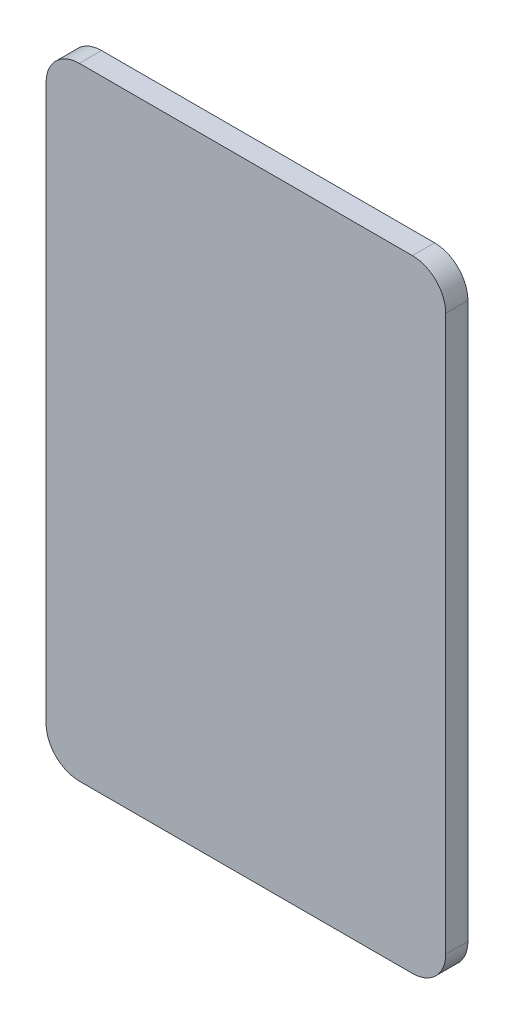
from build123d import *

# Parameters (mm, degrees)
BOSS_EXTRUDE1_DEPTH = 20


with BuildPart() as part:
    # Sketch1 → Boss-Extrude1 (new body)
    with BuildSketch(Plane.XY):
        with BuildLine():
            Line((-150, -280), (150, -280))
            ThreePointArc((150, -280), (171.213203436, -271.213203436), (180, -250))
            Line((180, -250), (180, 250))
            ThreePointArc((180, 250), (171.213203436, 271.213203436), (150, 280))
            Line((150, 280), (-150, 280))
            ThreePointArc((-150, 280), (-171.213203436, 271.213203436), (-180, 250))
            Line((-180, 250), (-180, -250))
            ThreePointArc((-180, -250), (-171.213203436, -271.213203436), (-150, -280))
        make_face()
    extrude(amount=BOSS_EXTRUDE1_DEPTH)


solid = part.part
